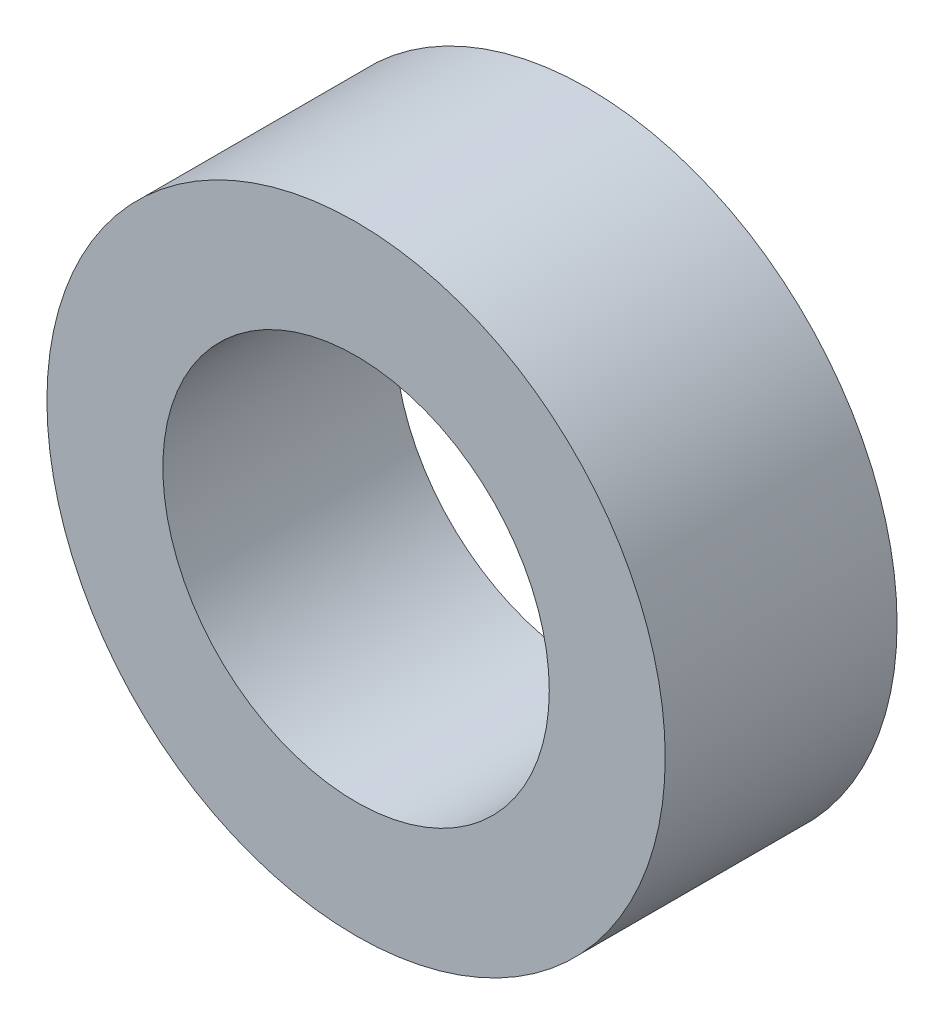
from build123d import *

# Parameters (mm, degrees)
SKETCH1_R      = 8
SKETCH1_R_2    = 5
EXTRUDE1_DEPTH = 6


with BuildPart() as part:
    # Sketch1 → Extrude1 (new body)
    with BuildSketch(Plane.XY):
        Circle(SKETCH1_R)
        Circle(SKETCH1_R_2, mode=Mode.SUBTRACT)
    extrude(amount=EXTRUDE1_DEPTH)


solid = part.part
